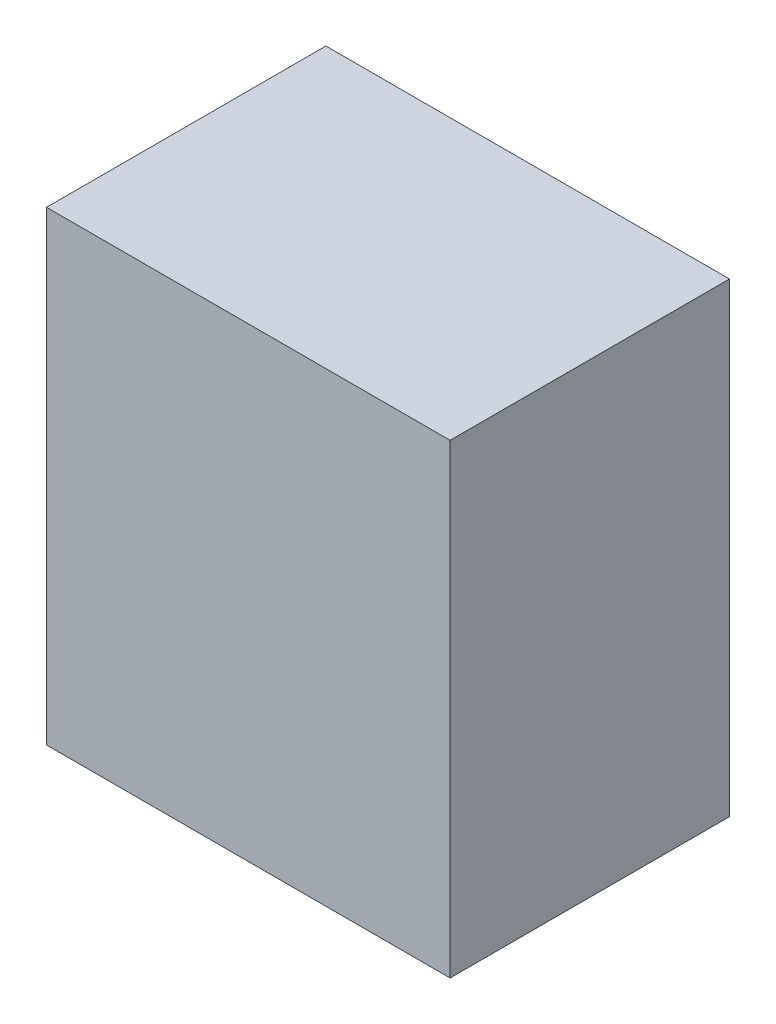
from build123d import *

# Parameters (mm, degrees)
PRESS_KONTROL_PANOSU_KUCUK_1_START = -120
SKETCH1_W                          = 260
SKETCH1_H                          = 300
PRESS_KONTROL_PANOSU_KUCUK_1_DEPTH = 180


with BuildPart() as part:
    # Sketch1 → PRESS_kontrol_panosu_kucuk_1 (new body)
    with BuildSketch(Plane.XY.offset(PRESS_KONTROL_PANOSU_KUCUK_1_START)):
        with Locations((510, 1550)):
            Rectangle(SKETCH1_W, SKETCH1_H)
    extrude(amount=-PRESS_KONTROL_PANOSU_KUCUK_1_DEPTH)


solid = part.part
